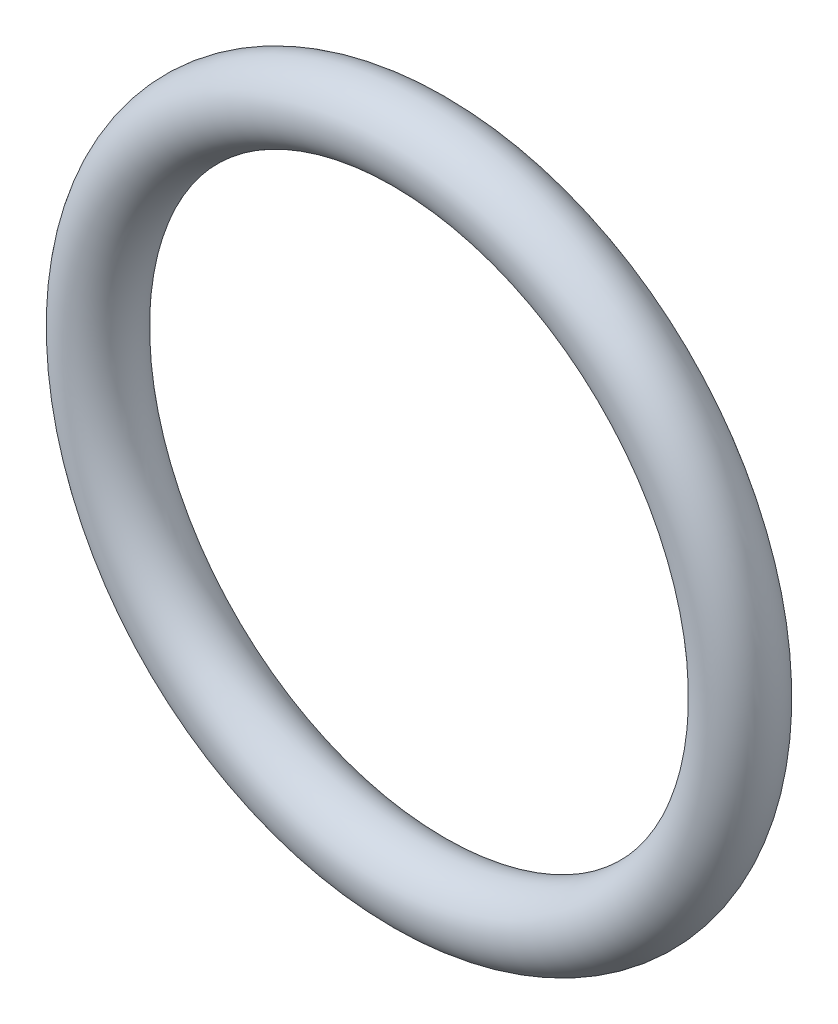
from build123d import *

# Parameters (mm, degrees)
SKETCH3_R = 1.2319


with BuildPart() as part:
    # Sweep1: sweep along a path in Sketch4
    with BuildLine(Plane.XY) as sweep1_path:
        CenterArc((0, 0), 10.8204, 0, 360)
    # Sketch3 → Sweep1 (sweep)
    with BuildSketch(Plane(origin=(0, 0, 0), x_dir=(0, 0, -1), z_dir=(1, 0, 0))):
        with Locations((0, -10.8204)):
            Circle(SKETCH3_R)
    sweep(path=sweep1_path.line)


solid = part.part
